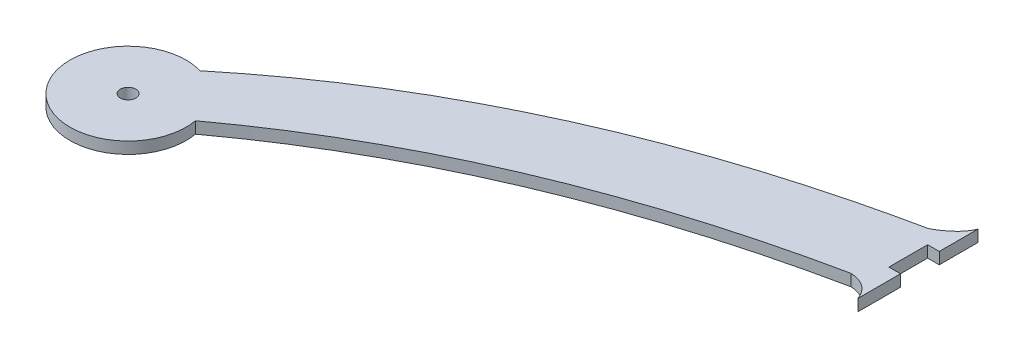
from build123d import *

# Parameters (mm, degrees)
BOSS_EXTRUDE2_DEPTH = 3
SKETCH4_R           = 2
CUT_EXTRUDE2_DEPTH  = 3


with BuildPart() as part:
    # Sketch3 → Boss-Extrude2 (new body)
    with BuildSketch(Plane(origin=(0, 0, 0), x_dir=(1, 0, 0), z_dir=(0, 1, 0))):
        with BuildLine():
            ThreePointArc((0, 20.000004284), (-15.361487959, -4.421029535), (10.567709202, 8.229620236))
            add(Edge.make_bspline(
                [(10.567709202, 8.229620236), (43.206989346, 32.255448903), (82.778918939, 49.08436074), (129.283499892, 58.71635639)],
                knots=[0.095561107, 0.095561107, 0.095561107, 0.095561107, 0.960221945, 0.960221945, 0.960221945, 0.960221945], degree=3))
            add(Edge.make_bspline(
                [(135.745739898, 54), (134.188411223, 58.347154687), (129.283499892, 58.71635639)],
                knots=[0, 0, 0, 1, 1, 1], degree=2))
            Line((135.745739898, 54), (135.745739898, 65))
            Line((135.745739898, 65), (132.745739898, 65))
            Line((132.745739898, 65), (132.745739898, 75))
            Line((132.745739898, 75), (135.745739898, 75))
            Line((135.745739898, 75), (135.745739898, 85))
            add(Edge.make_bspline(
                [(135.745739898, 85), (134.392955154, 81.542928592), (129.283499131, 78.716356348)],
                knots=[0, 0, 0, 1, 1, 1], degree=2))
            add(Edge.make_bspline(
                [(0, 20.000004284), (34.544798533, 48.4477318), (77.639296954, 68.019848628), (129.283499131, 78.716356348)],
                knots=[0, 0, 0, 0, 0.960221944, 0.960221944, 0.960221944, 0.960221944], degree=3))
        make_face()
    extrude(amount=BOSS_EXTRUDE2_DEPTH)

    # Sketch4 → Cut-Extrude2 (cut)
    with BuildSketch(Plane(origin=(0, 3, 0), x_dir=(1, 0, 0), z_dir=(0, 1, 0))):
        with Locations(Location((-4.199995888, 5.600003084, 0), (0, 0, 270))):
            Circle(SKETCH4_R)
    extrude(amount=-CUT_EXTRUDE2_DEPTH, mode=Mode.SUBTRACT)


solid = part.part
